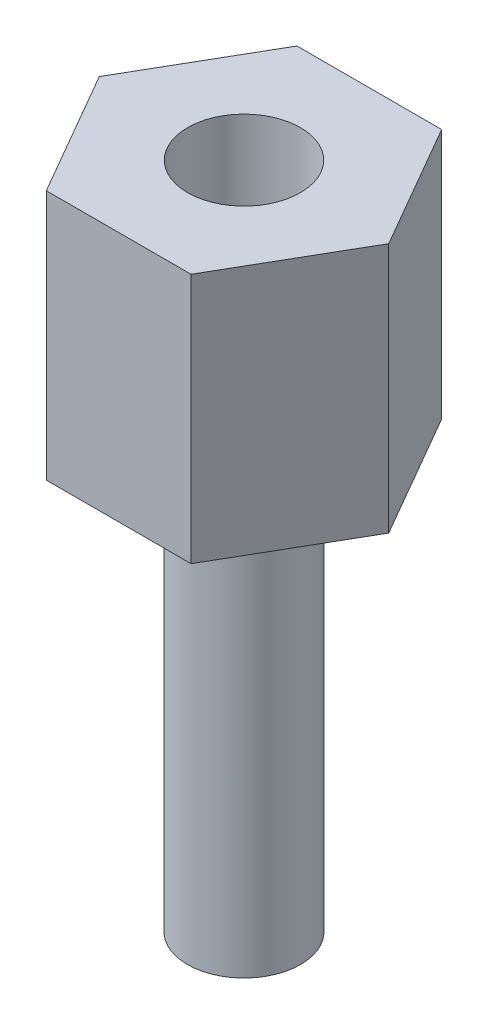
from build123d import *

# Parameters (mm, degrees)
BOSS_EXTRU_1_DEPTH      = 6
ESQUISSE2_R             = 1.353837959
BOSS_EXTRU_2_DEPTH      = 10
ESQUISSE3_R             = 1.35
ENL_V_MAT_EXTRU_1_DEPTH = 5


with BuildPart() as part:
    # Esquisse1 → Boss.-Extru.1 (new body)
    with BuildSketch(Plane(origin=(0, 0, 0), x_dir=(1, 0, 0), z_dir=(0, 1, 0))):
        Polygon((3.464101615, 0), (1.732050808, 3), (-1.732050808, 3), (-3.464101615, 0), (-1.732050808, -3), (1.732050808, -3), align=None)
    extrude(amount=BOSS_EXTRU_1_DEPTH)

    # Esquisse2 → Boss.-Extru.2 (add)
    with BuildSketch(Plane.XZ):
        with Locations(Location((0, 0, 0), (0, 0, 90))):
            Circle(ESQUISSE2_R)
    extrude(amount=BOSS_EXTRU_2_DEPTH)

    # Esquisse3 → Enlèv. mat.-Extru.1 (cut)
    with BuildSketch(Plane(origin=(0, 6, 0), x_dir=(1, 0, 0), z_dir=(0, 1, 0))):
        with Locations(Location((0, 0, 0), (0, 0, 270))):
            Circle(ESQUISSE3_R)
    extrude(amount=-ENL_V_MAT_EXTRU_1_DEPTH, mode=Mode.SUBTRACT)


solid = part.part
